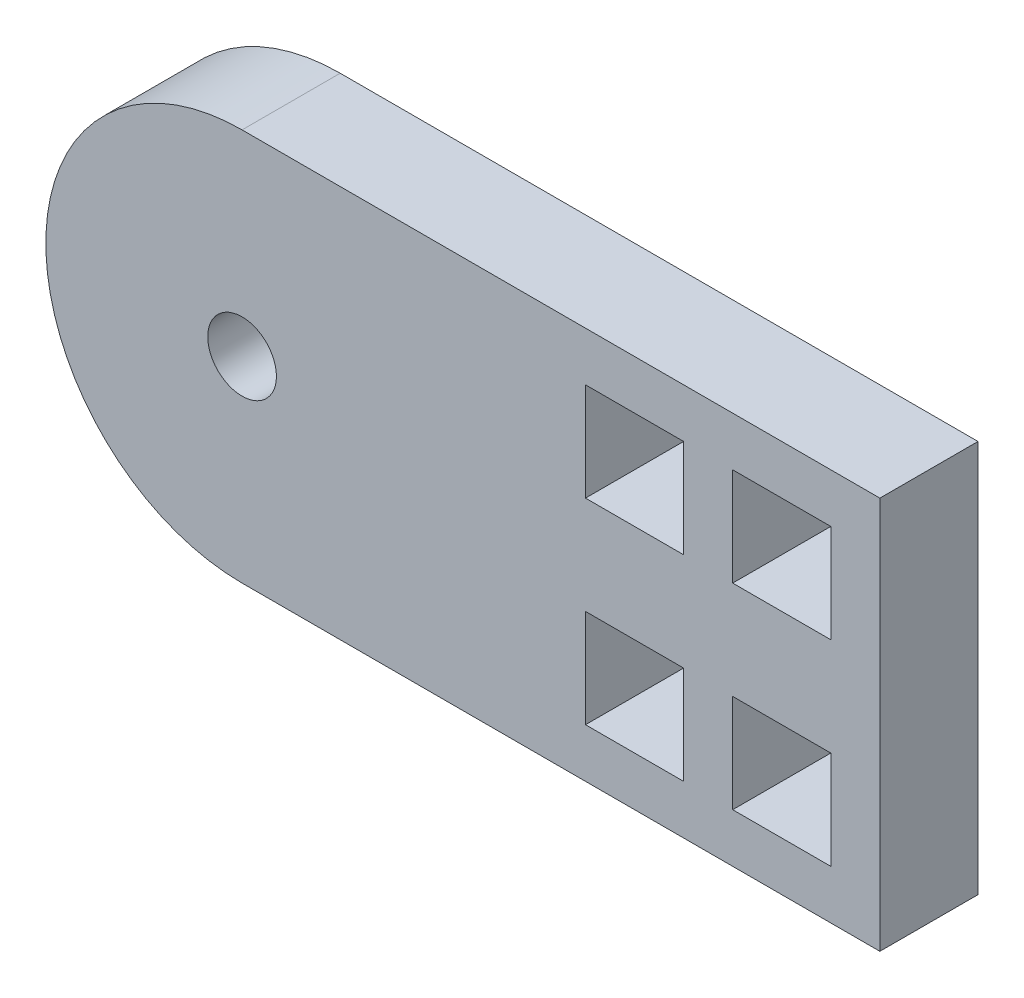
from build123d import *

# Parameters (mm, degrees)
SKETCH1_R           = 1.75
SKETCH1_W           = 5
SKETCH1_H           = 5
BOSS_EXTRUDE1_DEPTH = 5


with BuildPart() as part:
    # Sketch1 → Boss-Extrude1 (new body)
    with BuildSketch(Plane.XY):
        with BuildLine():
            Line((0, 10), (32.5, 10))
            Line((32.5, 10), (32.5, -10))
            Line((32.5, -10), (0, -10))
            ThreePointArc((0, -10), (-10, 0), (0, 10))
        make_face()
        Circle(SKETCH1_R, mode=Mode.SUBTRACT)
        with Locations((27.5, 5)):
            Rectangle(SKETCH1_W, SKETCH1_H, mode=Mode.SUBTRACT)
        with Locations((27.5, -5)):
            Rectangle(SKETCH1_W, SKETCH1_H, mode=Mode.SUBTRACT)
        with Locations((20, -5)):
            Rectangle(SKETCH1_W, SKETCH1_H, mode=Mode.SUBTRACT)
        with Locations((20, 5)):
            Rectangle(SKETCH1_W, SKETCH1_H, mode=Mode.SUBTRACT)
    extrude(amount=BOSS_EXTRUDE1_DEPTH)


solid = part.part
